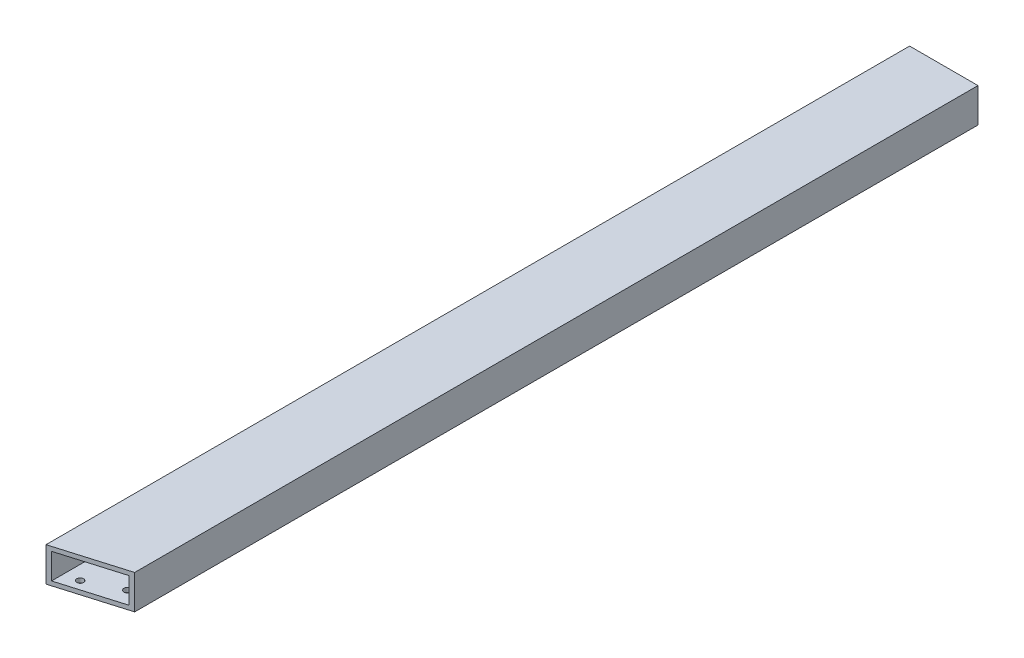
from build123d import *

# Parameters (mm, degrees)
BOSS_EXTRUDE1_DEPTH        = 320.675
BOSS_EXTRUDE1_DEPTH_BACK   = 320.675
SKETCH3_W                  = 50.8
SKETCH3_H                  = 25.4
SKETCH3_W_2                = 44.45
SKETCH3_H_2                = 19.05
CUT_EXTRUDE1_DEPTH         = 323.680609311
CUT_EXTRUDE1_DEPTH_BACK    = 323.680609311
F_10_CLEARANCE_HOLE1_D     = 4.9784
F_10_CLEARANCE_HOLE1_DEPTH = 5.08
F_10_CLEARANCE_HOLE1_TIP   = 1.495662253


with BuildPart() as part:
    # Sketch3 → Boss-Extrude1 (new, two sides: drawn at the far end of the back side and taken through both)
    with BuildSketch(Plane.XY.offset(-BOSS_EXTRUDE1_DEPTH_BACK)):
        Rectangle(SKETCH3_W, SKETCH3_H)
        Rectangle(SKETCH3_W_2, SKETCH3_H_2, mode=Mode.SUBTRACT)
    extrude(amount=BOSS_EXTRUDE1_DEPTH + BOSS_EXTRUDE1_DEPTH_BACK)

    # Sketch4 → Cut-Extrude1 (cut, two sides: drawn at the far end of the back side and taken through both)
    with BuildSketch(Plane(origin=(0, 12.7, 0), x_dir=(1, 0, 0), z_dir=(0, 1, 0)).offset(-CUT_EXTRUDE1_DEPTH_BACK)):
        Polygon((1322.117470931, -320.675), (25.4, -320.675), (-25.4, -320.675), (25.4, -305.627354456), (1268.718301677, 62.660305034), (3837.350959621, 420.474595165), (3890.750128875, 37.139290131), align=None)
    extrude(amount=CUT_EXTRUDE1_DEPTH + CUT_EXTRUDE1_DEPTH_BACK, mode=Mode.SUBTRACT)

    # #10 Clearance Hole1
    with Locations(Plane(origin=(0, -12.7, 0), x_dir=(-1, 0, 0), z_dir=(0, -1, 0))):
        with Locations((-11.811, -264.460593775), (11.811, -275.746327933), (-11.811, -297.574221755), (11.811, -308.859955913)):
            Hole(F_10_CLEARANCE_HOLE1_D / 2, depth=F_10_CLEARANCE_HOLE1_DEPTH)
            with Locations((0, 0, -(F_10_CLEARANCE_HOLE1_DEPTH + F_10_CLEARANCE_HOLE1_TIP / 2))):  # 118° drill point
                Cone(0, F_10_CLEARANCE_HOLE1_D / 2, F_10_CLEARANCE_HOLE1_TIP, mode=Mode.SUBTRACT)


solid = part.part
